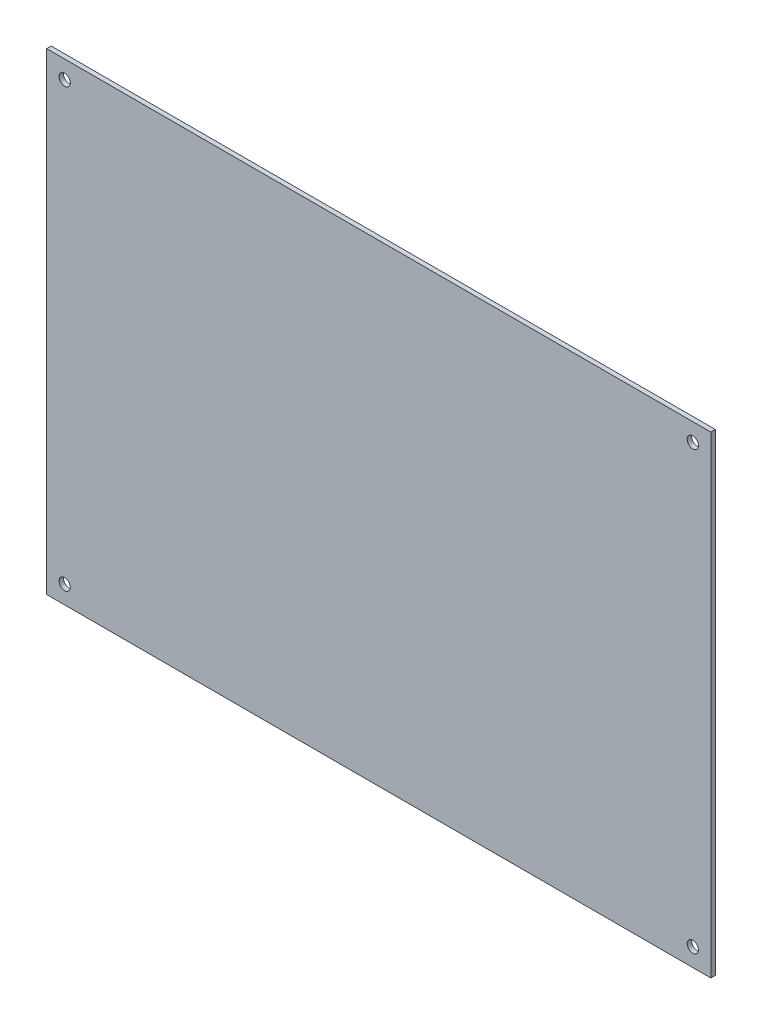
from build123d import *

# Parameters (mm, degrees)
SKETCH2_W               = 295
SKETCH2_H               = 210
BOSS_EXTRUDE1_DEPTH     = 2
SKETCH3_R               = 2.5
CUT_EXTRUDE1_DEPTH      = 10
MIRROR2_COPY_1_SKETCH_R = 2.5
MIRROR2_COPY_1_DEPTH    = 10


with BuildPart() as part:
    # Sketch2 → Boss-Extrude1 (new body)
    with BuildSketch(Plane.XY):
        Rectangle(SKETCH2_W, SKETCH2_H)
    extrude(amount=BOSS_EXTRUDE1_DEPTH)

    # Sketch3 → Cut-Extrude1 (cut)
    with BuildSketch(Plane.XY.offset(2)):
        with Locations((-139.5, 97)):
            Circle(SKETCH3_R)
    cut_extrude1 = extrude(amount=-CUT_EXTRUDE1_DEPTH, mode=Mode.SUBTRACT)

    # Mirror1: Cut-Extrude1 across plane
    add(cut_extrude1.mirror(Plane(origin=(0, 0, 0), x_dir=(0, 0, 1), z_dir=(1, 0, 0))), mode=Mode.SUBTRACT)

    # Mirror2: Cut-Extrude1 across plane
    add(cut_extrude1.mirror(Plane.ZX), mode=Mode.SUBTRACT)

    # Mirror2 copy 1 sketch → Mirror2 copy 1 (cut)
    with BuildSketch(Plane(origin=(0, 0, 2), x_dir=(-1, 0, 0), z_dir=(0, 0, 1))):
        with Locations((-139.5, 97)):
            Circle(MIRROR2_COPY_1_SKETCH_R)
    extrude(amount=-MIRROR2_COPY_1_DEPTH, mode=Mode.SUBTRACT)


solid = part.part
